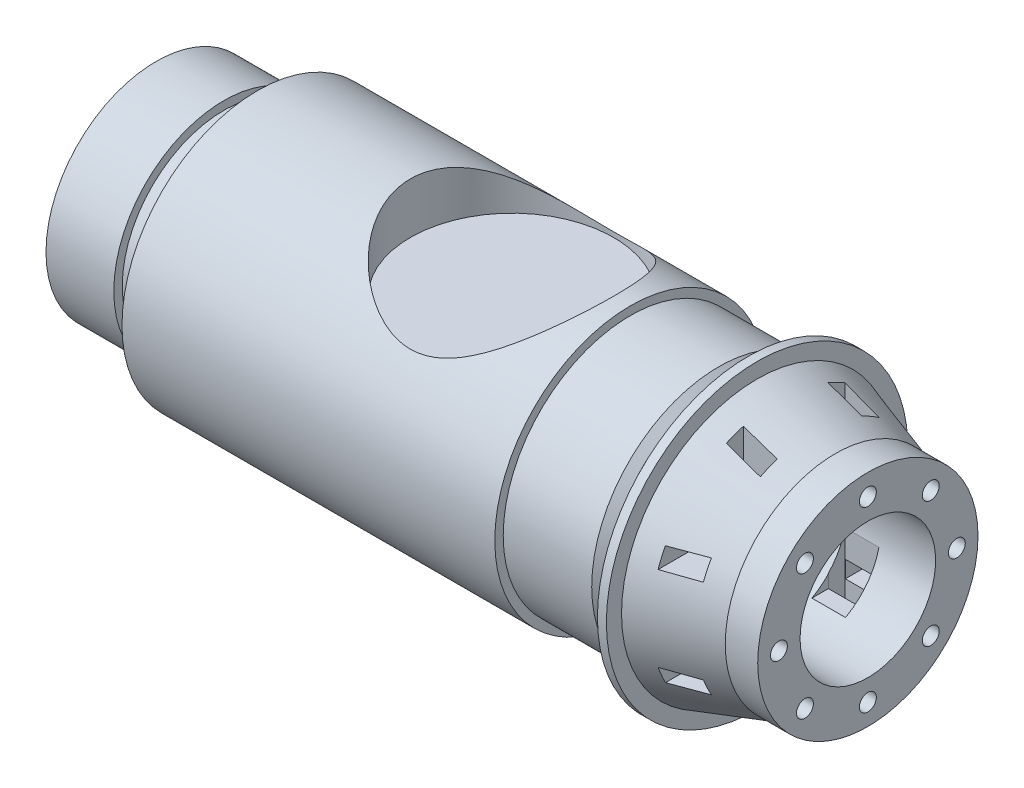
from build123d import *

# Parameters (mm, degrees)
SKETCH2_W               = 25.203593645
SKETCH2_H               = 76.2
SKETCH2_W_2             = 66.311902543
SKETCH2_H_2             = 95.27897735
SKETCH3_W               = 25.4
SKETCH3_H               = 12.7
CUT_EXTRUDE1_DEPTH      = 373.934318072
CUT_EXTRUDE2_DEPTH      = 328.295564346
CUT_EXTRUDE2_DEPTH_BACK = 328.295564346
SKETCH4_W               = 25.196915696
SKETCH4_H               = 12.7
SKETCH5_R               = 50.8
CUT_EXTRUDE3_DEPTH      = 557.821446487
SKETCH6_R               = 6.35
CUT_EXTRUDE4_DEPTH      = 25.4
CUT_EXTRUDE5_START      = -25.4
SKETCH7_R               = 6.35
CUT_EXTRUDE5_DEPTH      = 25.4
SKETCH8_R               = 76.2
CUT_EXTRUDE8_DEPTH      = 38.1


with BuildPart() as part:
    # Sketch2 → Revolve1 (revolve)
    with BuildSketch(Plane(origin=(0, 0, 0), x_dir=(1, 0, 0), z_dir=(0, 1, 0)), mode=Mode.PRIVATE) as revolve1_sk:
        Polygon((-266.7, 82.55), (-266.7, 0), (-215.9, 0), (-215.9, 76.2), (-215.9, 82.55), align=None)
        with Locations((-203.298203177, 38.1)):
            Rectangle(SKETCH2_W, SKETCH2_H)
        Polygon((-190.696406355, 76.2), (-190.696406355, 0), (88.703593645, 0), (88.703593645, 95.27897735), (88.703593645, 101.6), (-190.696406355, 101.6), align=None)
        with Locations((121.859544917, 47.639488675)):
            Rectangle(SKETCH2_W_2, SKETCH2_H_2)
        Polygon((155.015496188, 95.27897735), (155.015496188, 0), (166.010986047, 0), (166.010986047, 95.27897735), (160.513241117, 89.781232421), align=None)
        Polygon((166.010986047, 95.27897735), (166.010986047, 0), (177.006475906, 0), (177.006475906, 95.27897735), (171.508730976, 89.781232421), align=None)
        Polygon((177.006475906, 95.27897735), (177.006475906, 0), (183.724405052, 0), (183.724405052, 101.62897735), (183.724405052, 112.992396356), (177.006475906, 112.992396356), align=None)
        Polygon((183.724405052, 101.62897735), (183.724405052, 0), (266.7, 0), (266.7, 82.55), (242.364065099, 82.55), align=None)
    revolve(revolve1_sk.sketch.rotate(Axis((-266.7, 0, 0), (1, 0, 0)), 180), axis=Axis((-266.7, 0, 0), (1, 0, 0)))

    # Sketch3 → Cut-Extrude1 (cut, through all)
    with BuildSketch(Plane(origin=(0, 121.92, 0), x_dir=(1, 0, 0), z_dir=(0, 1, 0))):
        with Locations((212.824212149, 43.140904216)):
            Rectangle(SKETCH3_W, SKETCH3_H)
        with Locations((212.824212149, -33.059095784)):
            Rectangle(SKETCH3_W, SKETCH3_H)
    extrude(amount=-CUT_EXTRUDE1_DEPTH, mode=Mode.SUBTRACT)

    # Sketch4 → Cut-Extrude2 (cut, two sides: drawn at the far end of the back side and taken through both)
    with BuildSketch(Plane(origin=(0, 0, 39.409095784), x_dir=(-1, 0, 0), z_dir=(0, 0, -1)).offset(-CUT_EXTRUDE2_DEPTH_BACK)):
        with Locations((-212.925754301, 38.015203285)):
            Rectangle(SKETCH4_W, SKETCH4_H)
        with Locations((-212.925754301, -38.184796715)):
            Rectangle(SKETCH4_W, SKETCH4_H)
    extrude(amount=CUT_EXTRUDE2_DEPTH + CUT_EXTRUDE2_DEPTH_BACK, mode=Mode.SUBTRACT)

    # Sketch5 → Cut-Extrude3 (cut, through all)
    with BuildSketch(Plane.ZY.offset(266.7)):
        Circle(SKETCH5_R)
    extrude(amount=-CUT_EXTRUDE3_DEPTH, mode=Mode.SUBTRACT)

    # Sketch6 → Cut-Extrude4 (cut)
    with BuildSketch(Plane.ZY.offset(266.7)):
        with Locations((0, 66.675)):
            Circle(SKETCH6_R)
        with Locations((47.146344636, 47.146344636)):
            Circle(SKETCH6_R)
        with Locations((66.675, 0)):
            Circle(SKETCH6_R)
        with Locations((47.146344636, -47.146344636)):
            Circle(SKETCH6_R)
        with Locations((0, -66.675)):
            Circle(SKETCH6_R)
        with Locations((-47.146344636, -47.146344636)):
            Circle(SKETCH6_R)
        with Locations((-66.675, 0)):
            Circle(SKETCH6_R)
        with Locations((-47.146344636, 47.146344636)):
            Circle(SKETCH6_R)
    extrude(amount=-CUT_EXTRUDE4_DEPTH, mode=Mode.SUBTRACT)

    # Sketch7 → Cut-Extrude5 (cut)
    with BuildSketch(Plane(origin=(266.7, 0, 0), x_dir=(0, 0, -1), z_dir=(1, 0, 0)).offset(CUT_EXTRUDE5_START)):
        with Locations(Location((0, 66.675, 0), (0, 0, 180))):
            Circle(SKETCH7_R)
        with Locations(Location((47.146344636, 47.146344636, 0), (0, 0, 180))):
            Circle(SKETCH7_R)
        with Locations(Location((66.675, 0, 0), (0, 0, 180))):
            Circle(SKETCH7_R)
        with Locations(Location((47.146344636, -47.146344636, 0), (0, 0, 180))):
            Circle(SKETCH7_R)
        with Locations(Location((0, -66.675, 0), (0, 0, 180))):
            Circle(SKETCH7_R)
        with Locations(Location((-47.146344636, -47.146344636, 0), (0, 0, 180))):
            Circle(SKETCH7_R)
        with Locations(Location((-66.675, 0, 0), (0, 0, 180))):
            Circle(SKETCH7_R)
        with Locations(Location((-47.146344636, 47.146344636, 0), (0, 0, 180))):
            Circle(SKETCH7_R)
    extrude(amount=CUT_EXTRUDE5_DEPTH, mode=Mode.SUBTRACT)

    # Sketch8 → Cut-Extrude8 (cut)
    with BuildSketch(Plane(origin=(0, 101.6, 0), x_dir=(1, 0, 0), z_dir=(0, 1, 0))):
        with Locations(Location((0, 0, 0), (0, 0, 270))):
            Circle(SKETCH8_R)
    extrude(amount=-CUT_EXTRUDE8_DEPTH, mode=Mode.SUBTRACT)


solid = part.part
